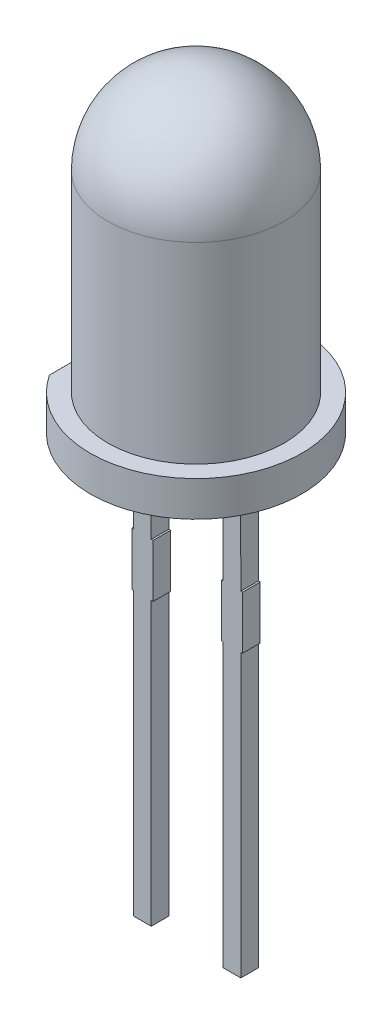
from build123d import *

# Parameters (mm, degrees)
BOSS_EXTRUDE1_DEPTH   = 1
BOSS_EXTRUDE2_DEPTH   = 0.25
BOSS_EXTRUDE2_2_DEPTH = 0.25
SKETCH9_R             = 0.6
CUT_EXTRUDE1_DEPTH    = 0.1
FILLET1_R             = 0.05


with BuildPart() as part:
    # Sketch1 → Boss-Extrude1 (new body)
    with BuildSketch(Plane(origin=(0, 0, 0), x_dir=(1, 0, 0), z_dir=(0, 1, 0))):
        with BuildLine():
            Line((-2.5, 0), (-2.5, 1.658312395))
            ThreePointArc((-2.5, 1.658312395), (3, 0), (-2.5, -1.658312395))
            Line((-2.5, -1.658312395), (-2.5, 0))
        make_face()
    extrude(amount=BOSS_EXTRUDE1_DEPTH)

    # Sketch3 → Revolve1 (revolve)
    with BuildSketch(Plane(origin=(0, 0, 0), x_dir=(0, 0, -1), z_dir=(1, 0, 0)), mode=Mode.PRIVATE) as revolve1_sk:
        with BuildLine():
            Line((0, 0.52609168), (0, 8.944899703))
            ThreePointArc((0, 8.944899703), (-1.767766953, 8.212666656), (-2.5, 6.444899703))
            Line((-2.5, 6.444899703), (-2.5, 0.52609168))
            Line((-2.5, 0.52609168), (0, 0.52609168))
        make_face()
    revolve(revolve1_sk.sketch.rotate(Axis((0, 0.52609168, 0), (0, 1, 0)), 180), axis=Axis((0, 0.52609168, 0), (0, 1, 0)))


with BuildPart() as body_2:
    # Sketch4 → Boss-Extrude2 (new, symmetric)
    with BuildSketch(Plane.XY):
        Polygon((-1.02, -3), (-1.02, 1.701510316), (-0.536851564, 1.701510316), (0.887769977, 4.479591393), (-1.265672404, 4.479591393), (-1.52, 4.227964623), (-1.52, -3), (-1.57, -3), (-1.57, -4.5), (-1.52, -4.5), (-1.52, -12.5), (-1.02, -12.5), (-1.02, -4.5), (-0.97, -4.5), (-0.97, -3), align=None)
    extrude(amount=BOSS_EXTRUDE2_DEPTH, both=True)


with BuildPart() as body_3:
    # Sketch4 → Boss-Extrude2 2 (new, symmetric)
    with BuildSketch(Plane.XY):
        Polygon((1.02, -3), (1.02, 1.701510316), (-0.191450203, 1.701510316), (1.27, 4.479591393), (1.504865449, 4.479591393), (1.52, -3), (1.57, -3), (1.57, -4.5), (1.52, -4.5), (1.52, -12.5), (1.02, -12.5), (1.02, -4.5), (0.97, -4.5), (0.97, -3), align=None)
    extrude(amount=BOSS_EXTRUDE2_2_DEPTH, both=True)


with BuildPart() as body_4:
    # Sketch6 → Revolve2 (revolve)
    with BuildSketch(Plane.XY, mode=Mode.PRIVATE) as revolve2_sk:
        Polygon((0.159275367, 4.501838224), (0.93823214, 4.501838224), (0.159275367, 2.991525598), align=None)
    revolve(revolve2_sk.sketch.rotate(Axis((0.159275367, 6.166765255, 0), (0, -1, 0)), 180), axis=Axis((0.159275367, 6.166765255, 0), (0, -1, 0)))


with BuildPart() as cut_extrude1_tool:
    # Sketch9 → Cut-Extrude1 (new body)
    with BuildSketch(Plane(origin=(0, 4.501838224, 0), x_dir=(1, 0, 0), z_dir=(0, 1, 0))):
        with Locations(Location((0.159275367, 0, 0), (0, 0, 180))):
            Circle(SKETCH9_R)
    extrude(amount=-CUT_EXTRUDE1_DEPTH)


with BuildPart() as part_1:
    add(part.part)

    # Cut-Extrude1: cut by cut_extrude1_tool
    add(cut_extrude1_tool.part, mode=Mode.SUBTRACT)

    # Fillet1
    fillet1_edges = [part_1.edges().sort_by_distance(p)[0] for p in [
        (0.759275367, 4.501838224, 0),
    ]]
    fillet(fillet1_edges, radius=FILLET1_R)


with BuildPart() as body_2_1:
    add(body_2.part)

    # Cut-Extrude1: cut by cut_extrude1_tool
    add(cut_extrude1_tool.part, mode=Mode.SUBTRACT)


with BuildPart() as body_4_1:
    add(body_4.part)

    # Cut-Extrude1: cut by cut_extrude1_tool
    add(cut_extrude1_tool.part, mode=Mode.SUBTRACT)


solid = Compound([body_3.part, part_1.part, body_2_1.part, body_4_1.part])
